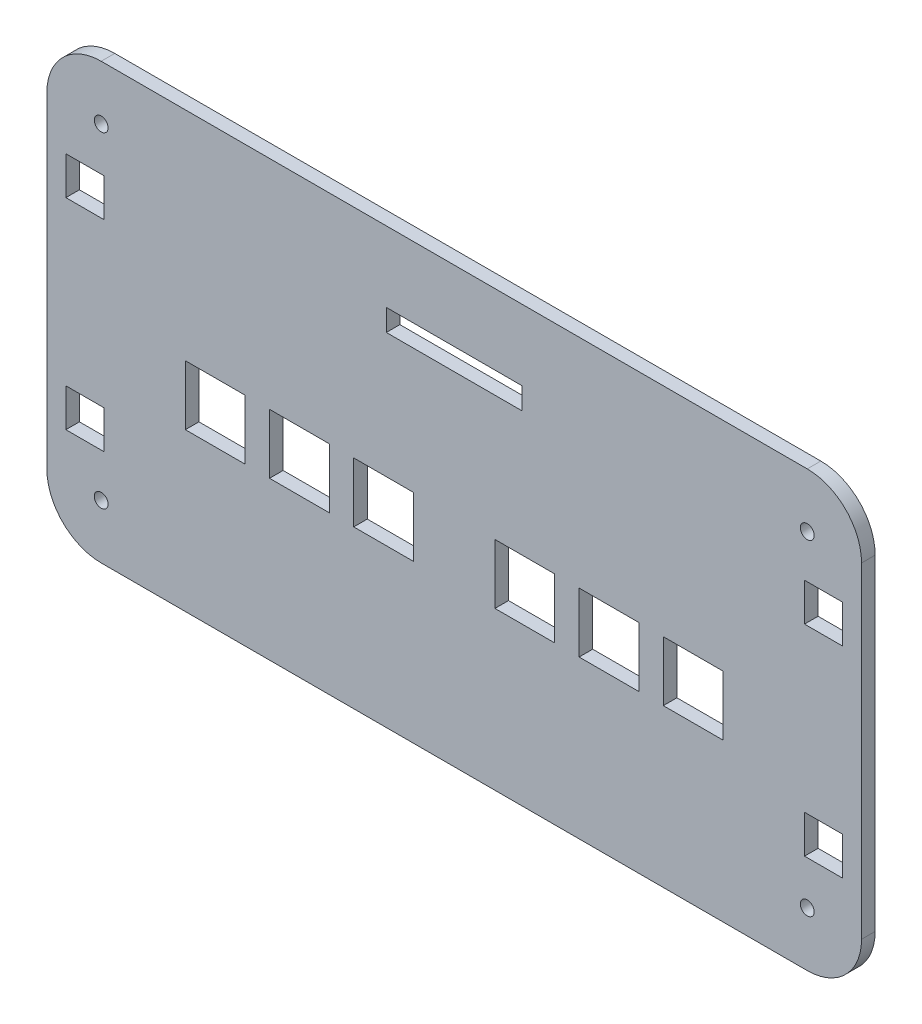
from build123d import *

# Parameters (mm, degrees)
SKETCH_2_R      = 2.55
SKETCH_2_W      = 22
SKETCH_2_H      = 22
SKETCH_2_W_2    = 14
SKETCH_2_H_2    = 14
SKETCH_2_W_3    = 50
SKETCH_2_H_3    = 8
EXTRUDE_1_DEPTH = 5


with BuildPart() as part:
    # 草图2 → 凸台-拉伸1 (new body)
    with BuildSketch(Plane.XY):
        with BuildLine():
            Line((-130, -130), (130, -130))
            ThreePointArc((130, -130), (144.142135624, -124.142135624), (150, -110))
            Line((150, -110), (150, 10))
            ThreePointArc((150, 10), (144.142135624, 24.142135624), (130, 30))
            Line((130, 30), (-130, 30))
            ThreePointArc((-130, 30), (-144.142135624, 24.142135624), (-150, 10))
            Line((-150, 10), (-150, -110))
            ThreePointArc((-150, -110), (-144.142135624, -124.142135624), (-130, -130))
        make_face()
        with Locations((130, -110)):
            Circle(SKETCH_2_R, mode=Mode.SUBTRACT)
        with Locations((130, 10)):
            Circle(SKETCH_2_R, mode=Mode.SUBTRACT)
        with Locations((-130, -110)):
            Circle(SKETCH_2_R, mode=Mode.SUBTRACT)
        with Locations((-130, 10)):
            Circle(SKETCH_2_R, mode=Mode.SUBTRACT)
        with Locations((-26, -61)):
            Rectangle(SKETCH_2_W, SKETCH_2_H, mode=Mode.SUBTRACT)
        with Locations((-57, -61)):
            Rectangle(SKETCH_2_W, SKETCH_2_H, mode=Mode.SUBTRACT)
        with Locations((-88, -61)):
            Rectangle(SKETCH_2_W, SKETCH_2_H, mode=Mode.SUBTRACT)
        with Locations((26, -61)):
            Rectangle(SKETCH_2_W, SKETCH_2_H, mode=Mode.SUBTRACT)
        with Locations((57, -61)):
            Rectangle(SKETCH_2_W, SKETCH_2_H, mode=Mode.SUBTRACT)
        with Locations((88, -61)):
            Rectangle(SKETCH_2_W, SKETCH_2_H, mode=Mode.SUBTRACT)
        with Locations((136, -87)):
            Rectangle(SKETCH_2_W_2, SKETCH_2_H_2, mode=Mode.SUBTRACT)
        with Locations((136, -13)):
            Rectangle(SKETCH_2_W_2, SKETCH_2_H_2, mode=Mode.SUBTRACT)
        Rectangle(SKETCH_2_W_3, SKETCH_2_H_3, mode=Mode.SUBTRACT)
        with Locations((-136, -87)):
            Rectangle(SKETCH_2_W_2, SKETCH_2_H_2, mode=Mode.SUBTRACT)
        with Locations((-136, -13)):
            Rectangle(SKETCH_2_W_2, SKETCH_2_H_2, mode=Mode.SUBTRACT)
    extrude(amount=EXTRUDE_1_DEPTH)


solid = part.part
